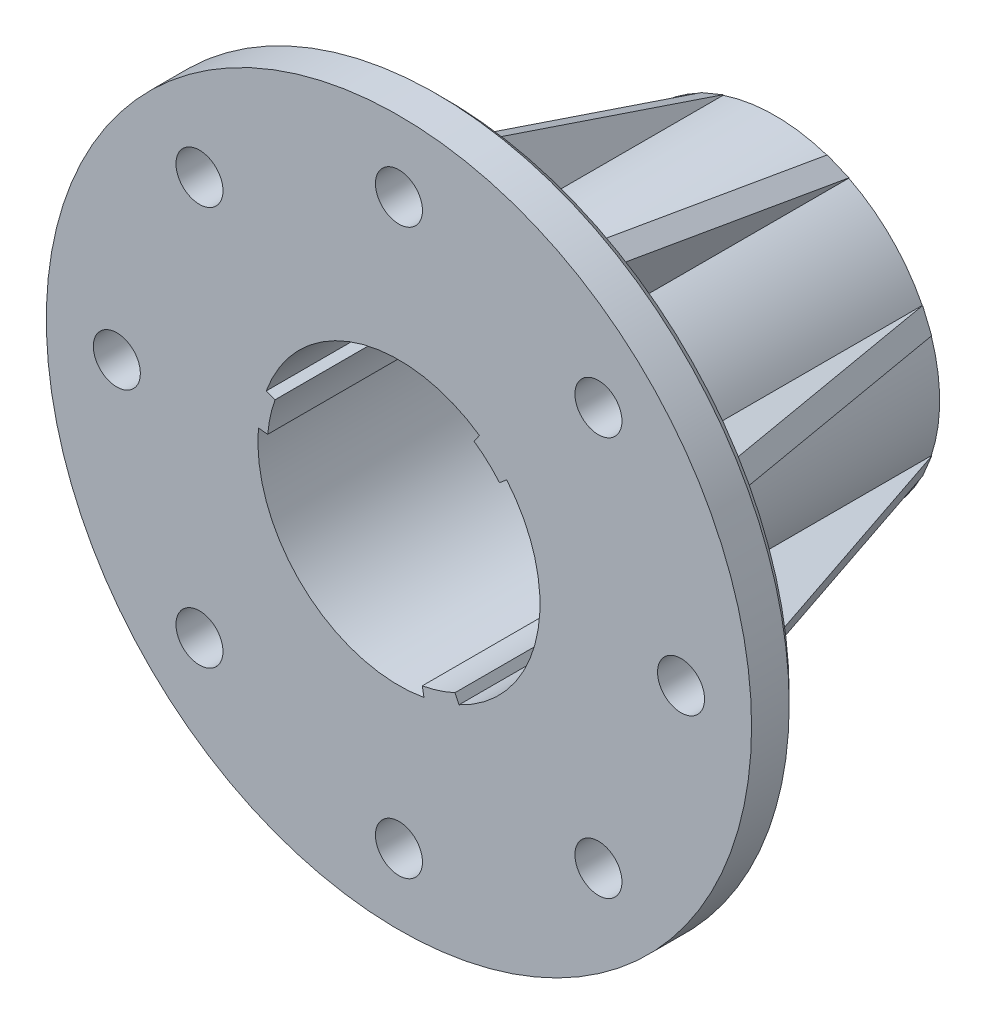
from build123d import *

# Parameters (mm, degrees)
SKETCH1_R           = 22.225
SKETCH1_R_2         = 17.78
BOSS_EXTRUDE1_DEPTH = 50.8
SKETCH2_R           = 47.625
SKETCH2_R_2         = 22.225
BOSS_EXTRUDE2_DEPTH = 6.35
SKETCH3_R           = 3.175
CUT_EXTRUDE1_DEPTH  = 85.361847123
CHAMFER1_SIZE       = 1.27
BOSS_EXTRUDE3_DEPTH = 1.5875
CIRPATTERN1_COUNT   = 8
CUT_EXTRUDE3_DEPTH  = 85.361847123


with BuildPart() as part:
    # Sketch1 → Boss-Extrude1 (new body)
    with BuildSketch(Plane.XY):
        Circle(SKETCH1_R)
        Circle(SKETCH1_R_2, mode=Mode.SUBTRACT)
    extrude(amount=BOSS_EXTRUDE1_DEPTH)



with BuildPart() as body_2:
    # Sketch2 → Boss-Extrude2 (new body)
    with BuildSketch(Plane.XY.offset(50.8)):
        Circle(SKETCH2_R)
        Circle(SKETCH2_R_2, mode=Mode.SUBTRACT)
    extrude(amount=-BOSS_EXTRUDE2_DEPTH)

    # Sketch3 → Cut-Extrude1 (cut, through all)
    with BuildSketch(Plane.XY.offset(50.8)):
        with Locations((-38.1, 0)):
            Circle(SKETCH3_R)
        with Locations((-26.940768363, 26.940768363)):
            Circle(SKETCH3_R)
        with Locations((0, 38.1)):
            Circle(SKETCH3_R)
        with Locations((26.940768363, 26.940768363)):
            Circle(SKETCH3_R)
        with Locations((38.1, 0)):
            Circle(SKETCH3_R)
        with Locations((26.940768363, -26.940768363)):
            Circle(SKETCH3_R)
        with Locations((0, -38.1)):
            Circle(SKETCH3_R)
        with Locations((-26.940768363, -26.940768363)):
            Circle(SKETCH3_R)
    extrude(amount=-CUT_EXTRUDE1_DEPTH, mode=Mode.SUBTRACT)

    # Chamfer1
    chamfer1_edges = [body_2.edges().sort_by_distance(p)[0] for p in [
        (-47.625, 0, 44.45),
    ]]
    chamfer(chamfer1_edges, length=CHAMFER1_SIZE)


with BuildPart() as part_1:
    add(part.part)

    add(body_2.part)  # Boss-Extrude3 merges body 2
    # Sketch4 → Boss-Extrude3 (add, symmetric)
    with BuildSketch(Plane(origin=(0, 0, 0), x_dir=(0, 0, -1), z_dir=(0.9238795325112865, -0.3826834323650906, 0))):
        Polygon((-44.45, 34.925), (0, 22.225), (0, 21.463), (-44.45, 21.463), align=None)
    boss_extrude3 = extrude(amount=BOSS_EXTRUDE3_DEPTH, both=True)

    # CirPattern1: Boss-Extrude3 ×8 about axis
    cirpattern1_axis = Axis((0, 0, 44.45), (0, 0, 1))
    for i in range(1, CIRPATTERN1_COUNT):
        add(boss_extrude3.rotate(cirpattern1_axis, i * 360 / CIRPATTERN1_COUNT))

    # Sketch6 → Cut-Extrude3 (cut, through all)
    with BuildSketch(Plane(origin=(0, 0, 0), x_dir=(-1, 0, 0), z_dir=(0, 0, -1))):
        with BuildLine():
            ThreePointArc((-10.145726618, 14.601117471), (5.407518283, 16.937743239), (16.729503733, 6.020972085))
            Line((16.729503733, 6.020972085), (17.924468285, 6.45104152))
            ThreePointArc((17.924468285, 6.45104152), (5.793769589, 18.147582041), (-10.870421376, 15.644054433))
            Line((-10.870421376, 15.644054433), (-10.145726618, 14.601117471))
        make_face()
        with BuildLine():
            Line((18.983359245, 1.592033845), (17.717801962, 1.485898255))
            ThreePointArc((17.717801962, 1.485898255), (11.964756786, -13.151919824), (-3.150437085, -17.498661268))
            Line((-3.150437085, -17.498661268), (-3.375468305, -18.748565644))
            ThreePointArc((-3.375468305, -18.748565644), (12.81938227, -14.091342669), (18.983359245, 1.592033845))
        make_face()
        with BuildLine():
            ThreePointArc((-7.572075345, -16.087015726), (-17.372275069, -3.785823414), (-13.579066648, 11.477689183))
            Line((-13.579066648, 11.477689183), (-14.54899998, 12.297524124))
            ThreePointArc((-14.54899998, 12.297524124), (-18.61315186, -4.056239373), (-8.112937869, -17.236088278))
            Line((-8.112937869, -17.236088278), (-7.572075345, -16.087015726))
        make_face()
    extrude(amount=-CUT_EXTRUDE3_DEPTH, mode=Mode.SUBTRACT)


solid = part_1.part
